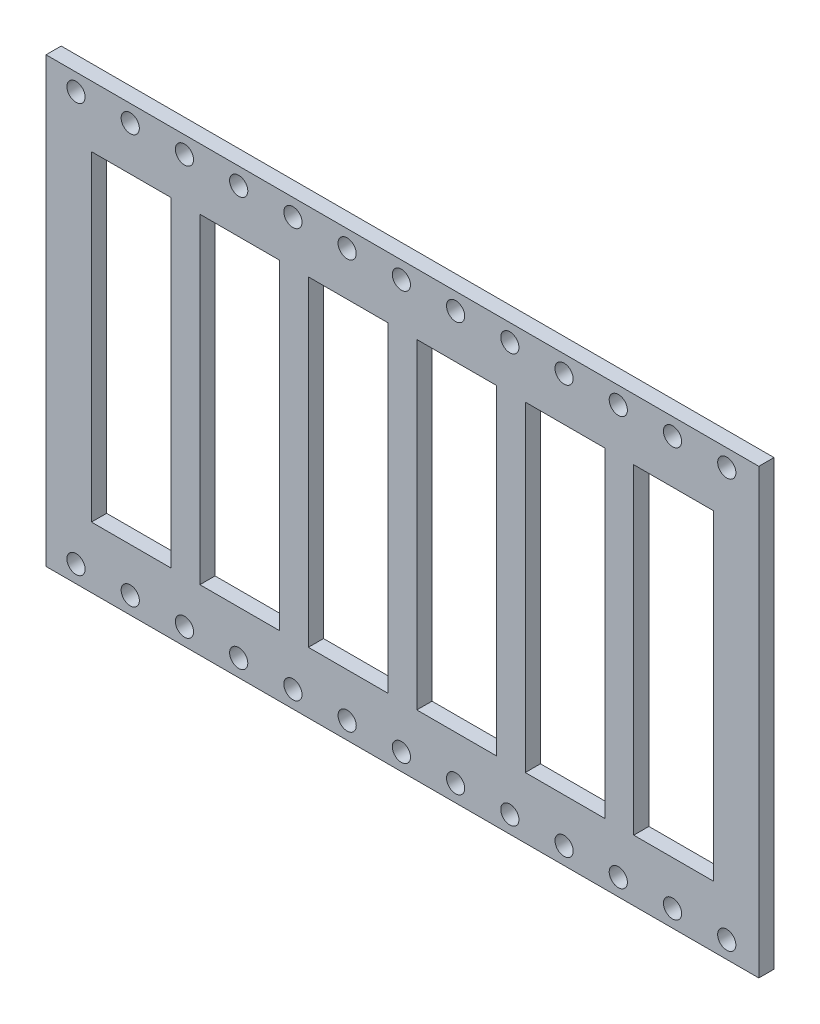
from build123d import *

# Parameters (mm, degrees)
SKETCH1_W           = 469.9
SKETCH1_H           = 292.14
SKETCH1_R           = 6
SKETCH1_W_2         = 52.5
SKETCH1_H_2         = 211.5
BOSS_EXTRUDE1_DEPTH = 10


with BuildPart() as part:
    # Sketch1 → Boss-Extrude1 (new body)
    with BuildSketch(Plane.XY):
        with Locations((213, 105.75)):
            Rectangle(SKETCH1_W, SKETCH1_H)
        with Locations((33.57, -29.046453277)):
            Circle(SKETCH1_R, mode=Mode.SUBTRACT)
        with Locations((69.32, -29.046453277)):
            Circle(SKETCH1_R, mode=Mode.SUBTRACT)
        with Locations((105.07, -29.046453277)):
            Circle(SKETCH1_R, mode=Mode.SUBTRACT)
        with Locations((140.82, -29.046453277)):
            Circle(SKETCH1_R, mode=Mode.SUBTRACT)
        with Locations((176.57, -29.046453277)):
            Circle(SKETCH1_R, mode=Mode.SUBTRACT)
        with Locations((212.32, -29.046453277)):
            Circle(SKETCH1_R, mode=Mode.SUBTRACT)
        with Locations((248.07, -29.046453277)):
            Circle(SKETCH1_R, mode=Mode.SUBTRACT)
        with Locations((283.82, -29.046453277)):
            Circle(SKETCH1_R, mode=Mode.SUBTRACT)
        with Locations((319.57, -29.046453277)):
            Circle(SKETCH1_R, mode=Mode.SUBTRACT)
        with Locations((355.32, -29.046453277)):
            Circle(SKETCH1_R, mode=Mode.SUBTRACT)
        with Locations((391.07, -29.046453277)):
            Circle(SKETCH1_R, mode=Mode.SUBTRACT)
        with Locations((426.82, -29.046453277)):
            Circle(SKETCH1_R, mode=Mode.SUBTRACT)
        with Locations((-2.18, 240.546453277)):
            Circle(SKETCH1_R, mode=Mode.SUBTRACT)
        with Locations((33.57, 240.546453277)):
            Circle(SKETCH1_R, mode=Mode.SUBTRACT)
        with Locations((69.32, 240.546453277)):
            Circle(SKETCH1_R, mode=Mode.SUBTRACT)
        with Locations((105.07, 240.546453277)):
            Circle(SKETCH1_R, mode=Mode.SUBTRACT)
        with Locations((140.82, 240.546453277)):
            Circle(SKETCH1_R, mode=Mode.SUBTRACT)
        with Locations((176.57, 240.546453277)):
            Circle(SKETCH1_R, mode=Mode.SUBTRACT)
        with Locations((212.32, 240.546453277)):
            Circle(SKETCH1_R, mode=Mode.SUBTRACT)
        with Locations((-2.18, -29.046453277)):
            Circle(SKETCH1_R, mode=Mode.SUBTRACT)
        with Locations((248.07, 240.546453277)):
            Circle(SKETCH1_R, mode=Mode.SUBTRACT)
        with Locations((283.82, 240.546453277)):
            Circle(SKETCH1_R, mode=Mode.SUBTRACT)
        with Locations((319.57, 240.546453277)):
            Circle(SKETCH1_R, mode=Mode.SUBTRACT)
        with Locations((355.32, 240.546453277)):
            Circle(SKETCH1_R, mode=Mode.SUBTRACT)
        with Locations((391.07, 240.546453277)):
            Circle(SKETCH1_R, mode=Mode.SUBTRACT)
        with Locations((426.82, 240.546453277)):
            Circle(SKETCH1_R, mode=Mode.SUBTRACT)
        with Locations((34.25, 105.75)):
            Rectangle(SKETCH1_W_2, SKETCH1_H_2, mode=Mode.SUBTRACT)
        with Locations((105.75, 105.75)):
            Rectangle(SKETCH1_W_2, SKETCH1_H_2, mode=Mode.SUBTRACT)
        with Locations((177.25, 105.75)):
            Rectangle(SKETCH1_W_2, SKETCH1_H_2, mode=Mode.SUBTRACT)
        with Locations((248.75, 105.75)):
            Rectangle(SKETCH1_W_2, SKETCH1_H_2, mode=Mode.SUBTRACT)
        with Locations((320.25, 105.75)):
            Rectangle(SKETCH1_W_2, SKETCH1_H_2, mode=Mode.SUBTRACT)
        with Locations((391.75, 105.75)):
            Rectangle(SKETCH1_W_2, SKETCH1_H_2, mode=Mode.SUBTRACT)
    extrude(amount=BOSS_EXTRUDE1_DEPTH)


solid = part.part
